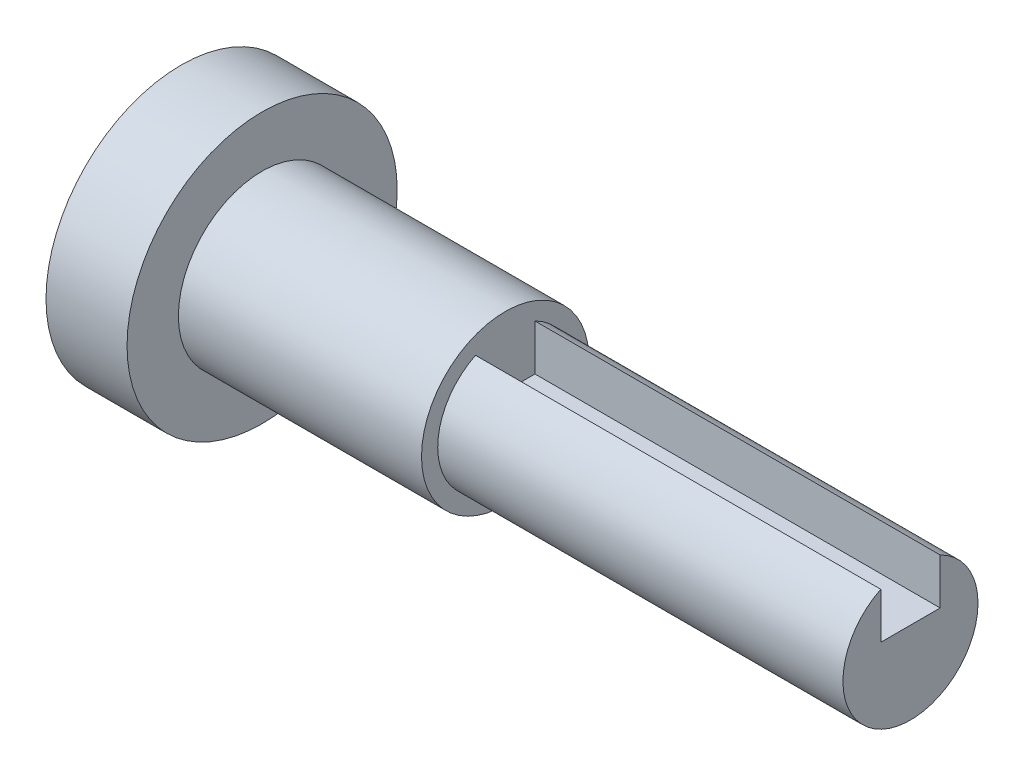
from build123d import *

# Parameters (mm, degrees)
CUT_EXTRUDE1_DEPTH = 15


with BuildPart() as part:
    # Sketch1 → Revolve1 (revolve)
    with BuildSketch(Plane.XY, mode=Mode.PRIVATE) as revolve1_sk:
        Polygon((0, 0), (27, 0), (27, 2.5), (12, 2.5), (12, 3.1), (3, 3.1), (3, 5), (0, 5), align=None)
    revolve(revolve1_sk.sketch.rotate(Axis((0, 0, 0), (1, 0, 0)), 90), axis=Axis((0, 0, 0), (1, 0, 0)))

    # Sketch2 → Cut-Extrude1 (cut)
    with BuildSketch(Plane(origin=(27, 0, 0), x_dir=(0, 0, -1), z_dir=(1, 0, 0))):
        Polygon((-1.1, 2.244994432), (-1.1, 0.544994432), (1.1, 0.544994432), (1.1, 2.244994432), (0, 3.059798295), align=None)
    extrude(amount=-CUT_EXTRUDE1_DEPTH, mode=Mode.SUBTRACT)


solid = part.part
